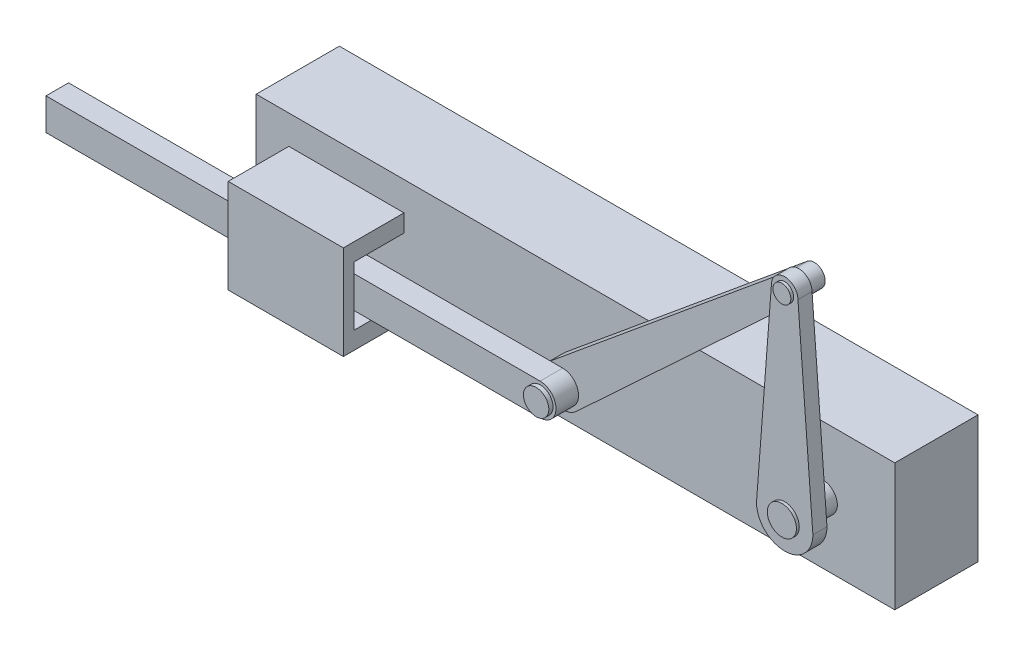
from build123d import *

# Parameters (mm, degrees)
SKETCH_1_W          = 115.019292035
SKETCH_1_H          = 22.927433628
EXTRUDE_1_DEPTH     = 14.986
SKETCH_2_R          = 2.628127437
EXTRUDE_2_DEPTH     = 7.366
EXTRUDE_3_DEPTH     = 2.54
EXTRUDE_4_DEPTH     = 2.794
SKETCH_6_R          = 1.611317842
EXTRUDE_5_DEPTH     = 0.508
EXTRUDE_6_DEPTH     = 4.064
SKETCH_8_W          = 20.74444914
SKETCH_8_H          = 3.147990337
SKETCH_8_H_2        = 3.147990336
EXTRUDE_7_DEPTH     = 10.922
SKETCH_9_W          = 20.74444914
SKETCH_9_H          = 1.904400454
EXTRUDE_8_DEPTH     = 10.922
SKETCH_10_R         = 2.28563118
EXTRUDE_9_DEPTH     = 0.762
SKETCH_11_R         = 1.571986642
EXTRUDE_10_DEPTH    = 3.302
SKETCH_12_W         = 17.575344956
SKETCH_12_H         = 16.755162191
EXTRUDE_11_DEPTH    = 13.462
SKETCH_13_R         = 1.331265642
SKETCH_13_R_2       = 1.077265642
CUT_EXTRUDE_1_DEPTH = 0.762
SKETCH_14_W         = 16.834327137
SKETCH_14_H         = 20.427018904
CUT_EXTRUDE_2_DEPTH = 28.194


with BuildPart() as part:
    # 草图1 → 凸台-拉伸1 (new body)
    with BuildSketch(Plane.XY):
        with Locations((14.25011379, -11.463716814)):
            Rectangle(SKETCH_1_W, SKETCH_1_H)
    extrude(amount=EXTRUDE_1_DEPTH)

    # 草图2 → 凸台-拉伸2 (add)
    with BuildSketch(Plane.XY.offset(14.986)):
        with Locations((58.785943209, -11.743523072)):
            Circle(SKETCH_2_R)
    extrude(amount=EXTRUDE_2_DEPTH)

    # 草图3 → 凸台-拉伸3 (add)
    with BuildSketch(Plane.XY.offset(21.844)):
        with BuildLine():
            Line((53.76517402, -10.973439102), (53.706459714, -11.743523072))
            ThreePointArc((53.706459714, -11.743523072), (58.785943209, -16.823006567), (63.865426703, -11.743523072))
            Line((63.865426703, -11.743523072), (63.806712398, -10.973439102))
            Line((63.806712398, -10.973439102), (61.171013627, 23.595808677))
            ThreePointArc((61.171013627, 23.595808677), (58.785943209, 25.980879095), (56.400872791, 23.595808677))
            Line((56.400872791, 23.595808677), (53.76517402, -10.973439102))
        make_face()
    extrude(amount=-EXTRUDE_3_DEPTH)

    # 草图5 → 凸台-拉伸4 (add)
    with BuildSketch(Plane(origin=(0, 0, 19.304), x_dir=(-1, 0, 0), z_dir=(0, 0, -1))):
        with BuildLine():
            Line((-57.536519865, 25.108887591), (-13.949230135, -10.883271683))
            ThreePointArc((-13.949230135, -10.883271683), (-13.53146296, -16.06321478), (-18.721435344, -16.328783135))
            Line((-18.721435344, -16.328783135), (-60.121986544, 22.158639689))
            ThreePointArc((-60.121986544, 22.158639689), (-60.261702819, 24.88909908), (-57.536519865, 25.108887591))
        make_face()
    extrude(amount=EXTRUDE_4_DEPTH)

    # 草图6 → 凸台-拉伸5 (add)
    with BuildSketch(Plane.XY.offset(21.844)):
        with Locations((58.785943209, 23.595808677)):
            Circle(SKETCH_6_R)
    extrude(amount=EXTRUDE_5_DEPTH)

    # 草图7 → 凸台-拉伸6 (add)
    with BuildSketch(Plane.XY.offset(19.304)):
        with BuildLine():
            Line((16.255391973, -10.80751129), (-72.73334393, -10.80751129))
            Line((-72.73334393, -10.80751129), (-72.73334393, -16.544656626))
            Line((-72.73334393, -16.544656626), (16.255391973, -16.544656626))
            ThreePointArc((16.255391973, -16.544656626), (19.123964641, -13.676083958), (16.255391973, -10.80751129))
        make_face()
    extrude(amount=EXTRUDE_6_DEPTH)

    # 草图8 → 凸台-拉伸7 (add)
    with BuildSketch(Plane.XY.offset(14.986)):
        with Locations((-27.006170601, -20.578235082)):
            Rectangle(SKETCH_8_W, SKETCH_8_H)
        with Locations((-27.006170601, -6.773932835)):
            Rectangle(SKETCH_8_W, SKETCH_8_H_2)
    extrude(amount=EXTRUDE_7_DEPTH)

    # 草图9 → 凸台-拉伸8 (add)
    with BuildSketch(Plane.XZ.offset(8.347928003)):
        with Locations((-27.006170601, 24.955799773)):
            Rectangle(SKETCH_9_W, SKETCH_9_H)
    extrude(amount=EXTRUDE_8_DEPTH)

    # 草图10 → 凸台-拉伸9 (add)
    with BuildSketch(Plane.XY.offset(23.368)):
        with Locations(Location((16.302879151, -13.669496202, 0), (0, 0, 180))):
            Circle(SKETCH_10_R)
    extrude(amount=EXTRUDE_9_DEPTH)

    # 草图11 → 凸台-拉伸10 (add)
    with BuildSketch(Plane(origin=(0, 0, 0), x_dir=(-1, 0, 0), z_dir=(0, 0, -1))):
        with Locations(Location((-59.445134238, -13.353735996, 0), (0, 0, 180))):
            Circle(SKETCH_11_R)
    extrude(amount=EXTRUDE_10_DEPTH)

    # 草图12 → 凸台-拉伸11 (add)
    with BuildSketch(Plane(origin=(0, 0, -3.302), x_dir=(-1, 0, 0), z_dir=(0, 0, -1))):
        with Locations((-59.093627339, -14.115334278)):
            Rectangle(SKETCH_12_W, SKETCH_12_H)
    extrude(amount=EXTRUDE_11_DEPTH)

    # 草图13 → 切除-拉伸1 (cut)
    with BuildSketch(Plane(origin=(0, 0, 16.51), x_dir=(-1, 0, 0), z_dir=(0, 0, -1))):
        with Locations((-58.850171018, 23.520615078)):
            Circle(SKETCH_13_R)
        with Locations((-58.850171018, 23.520615078)):
            Circle(SKETCH_13_R_2, mode=Mode.SUBTRACT)
    extrude(amount=-CUT_EXTRUDE_1_DEPTH, mode=Mode.SUBTRACT)

    # 草图14 → 切除-拉伸2 (cut)
    with BuildSketch(Plane(origin=(67.881299817, 0, 0), x_dir=(0, 0, -1), z_dir=(1, 0, 0))):
        with Locations((11.672099204, -13.921851865)):
            Rectangle(SKETCH_14_W, SKETCH_14_H)
    extrude(amount=-CUT_EXTRUDE_2_DEPTH, mode=Mode.SUBTRACT)


solid = part.part
